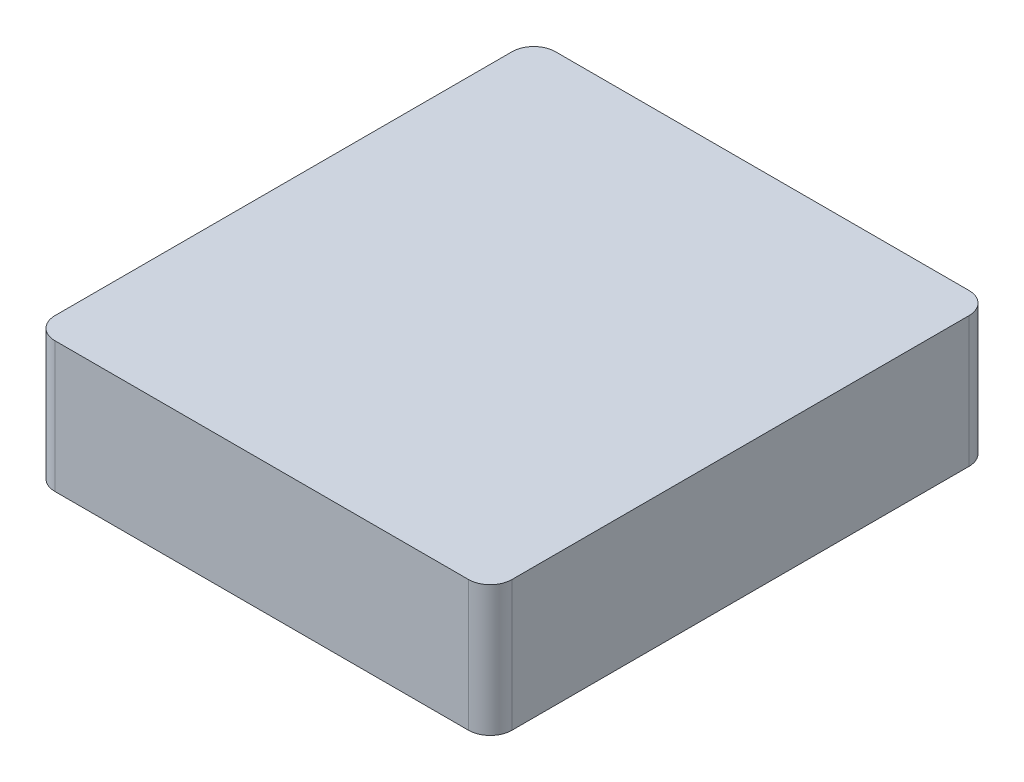
from build123d import *

# Parameters (mm, degrees)
SKETCH3_W           = 21
SKETCH3_H           = 23
BOSS_EXTRUDE2_DEPTH = 6
FILLET1_R           = 1


with BuildPart() as part:
    # Sketch3 → Boss-Extrude2 (new body)
    with BuildSketch(Plane(origin=(0, 0, 0), x_dir=(1, 0, 0), z_dir=(0, 1, 0))):
        Rectangle(SKETCH3_W, SKETCH3_H)
    extrude(amount=BOSS_EXTRUDE2_DEPTH)

    # Fillet1
    fillet1_edges = [part.edges().sort_by_distance(p)[0] for p in [
        (10.5, 3, 11.5),
        (-10.5, 3, 11.5),
        (-10.5, 3, -11.5),
        (10.5, 3, -11.5),
    ]]
    fillet(fillet1_edges, radius=FILLET1_R)


solid = part.part
